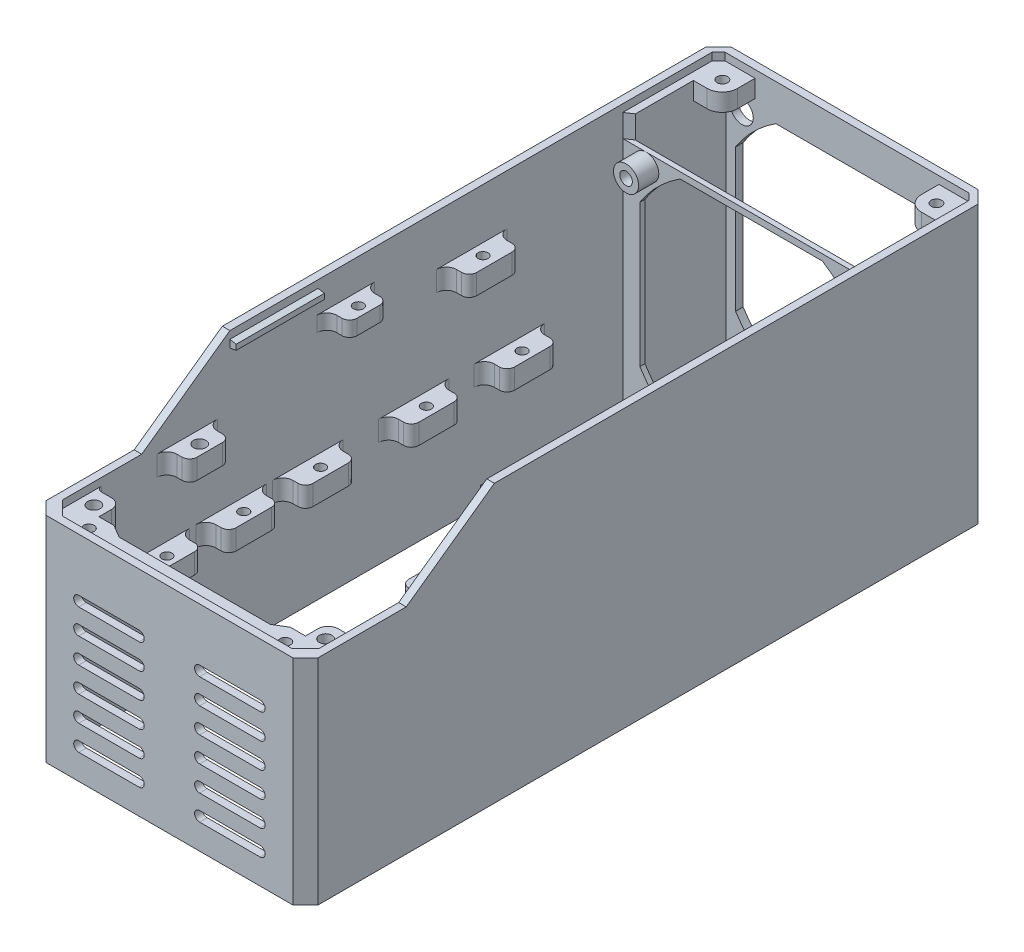
from build123d import *

# Parameters (mm, degrees)
CROQUIS2_W                   = 96
CROQUIS2_H                   = 36
SALIENTE_EXTRUIR1_DEPTH      = 110
CROQUIS3_R                   = 2
SALIENTE_EXTRUIR2_DEPTH      = 8
CROQUIS11_R                  = 2
SALIENTE_EXTRUIR7_DEPTH      = 8
MATRIZL1_COUNT               = 2
MATRIZL1_PITCH               = 38
MATRIZL2_COUNT               = 3
MATRIZL2_PITCH               = 30.5
SIMETR_A1_COPY_1_SKETCH_R    = 2
SIMETR_A1_COPY_1_DEPTH       = 8
SIMETR_A1_COPY_2_SKETCH_R    = 2
SIMETR_A1_COPY_2_DEPTH       = 8
SIMETR_A1_COPY_3_SKETCH_R    = 2
SIMETR_A1_COPY_3_DEPTH       = 8
CORTE_COOLER_DEPTH           = 93
CROQUIS5_R                   = 2.5
CORTE_COOLERAGUJEROS_DEPTH   = 57
EXTRUIR_INSERTOSCOOLER_START = 8
CROQUIS14_R                  = 5
CROQUIS14_R_2                = 2.5
EXTRUIR_INSERTOSCOOLER_DEPTH = 8
CROQUIS20_R                  = 4.5
CORTAR_EXTRUIR6_DEPTH        = 10
CORTAR_EXTRUIR4_DEPTH        = 12
SALIENTE_EXTRUIR10_START     = -3
CROQUIS16_R                  = 2.1
SALIENTE_EXTRUIR10_DEPTH     = 7
CORTAR_EXTRUIR5_DEPTH        = 3
CROQUIS9_R                   = 2
SALIENTE_EXTRUIR6_DEPTH      = 8
SOPORTEFRENTE_START          = 8
CROQUIS18_R                  = 2
SOPORTEFRENTE_DEPTH          = 6
CORTE_TAPABORNERA_DEPTH      = 123
CROQUIS13_R                  = 2.5
CROQUIS13_R_2                = 2.1
SALIENTE_EXTRUIR8_DEPTH      = 8
SALIENTE_CANALETA_DEPTH      = 35
CORTAR_EXTRUIR7_DEPTH        = 10


with BuildPart() as part:
    # Croquis2 → Saliente-Extruir1 (new body)
    with BuildSketch(Plane(origin=(0, 0, 0), x_dir=(1, 0, 0), z_dir=(0, 1, 0))):
        Polygon((49, 125), (-49, 125), (-54, 120), (-54, 0), (-54, -142), (-49, -147), (49, -147), (54, -142), (54, 0), (54, 120), align=None)
        Polygon((-51, 0), (-51, 84), (51, 84), (51, 0), (51, -138.5), (45.5, -144), (-45.5, -144), (-51, -138.5), align=None, mode=Mode.SUBTRACT)
        with Locations((0, 104)):
            Rectangle(CROQUIS2_W, CROQUIS2_H, mode=Mode.SUBTRACT)
    extrude(amount=SALIENTE_EXTRUIR1_DEPTH)

    # Croquis3 → Saliente-Extruir2 (add)
    with BuildSketch(Plane(origin=(0, 50, 0), x_dir=(1, 0, 0), z_dir=(0, 1, 0))):
        with BuildLine():
            Line((-45, 49), (-47, 49))
            ThreePointArc((-47, 49), (-49.828427125, 50.171572875), (-51, 53))
            Line((-51, 53), (-51, 25))
            ThreePointArc((-51, 25), (-49.828427125, 27.828427125), (-47, 29))
            Line((-47, 29), (-45, 29))
            ThreePointArc((-45, 29), (-42.878679656, 29.878679656), (-42, 32))
            Line((-42, 32), (-42, 46))
            ThreePointArc((-42, 46), (-42.878679656, 48.121320344), (-45, 49))
        make_face()
        with Locations(Location((-46, 39, 0), (0, 0, 270))):
            Circle(CROQUIS3_R, mode=Mode.SUBTRACT)
    saliente_extruir2 = extrude(amount=-SALIENTE_EXTRUIR2_DEPTH)

    # Croquis11 → Saliente-Extruir7 (add)
    with BuildSketch(Plane(origin=(0, 50, 0), x_dir=(1, 0, 0), z_dir=(0, 1, 0))):
        with BuildLine():
            ThreePointArc((-47, -31), (-49.828427125, -29.828427125), (-51, -27))
            Line((-51, -27), (-51, -55))
            ThreePointArc((-51, -55), (-49.828427125, -52.171572875), (-47, -51))
            Line((-47, -51), (-45, -51))
            ThreePointArc((-45, -51), (-42.878679656, -50.121320344), (-42, -48))
            Line((-42, -48), (-42, -34))
            ThreePointArc((-42, -34), (-42.878679656, -31.878679656), (-45, -31))
            Line((-45, -31), (-47, -31))
        make_face()
        with Locations(Location((-46, -41, 0), (0, 0, 270))):
            Circle(CROQUIS11_R, mode=Mode.SUBTRACT)
    saliente_extruir7 = extrude(amount=-SALIENTE_EXTRUIR7_DEPTH)

    # MatrizL1: Saliente-Extruir2 ×2
    with Locations(*[(0, 0, i * MATRIZL1_PITCH) for i in range(1, MATRIZL1_COUNT)]):
        add(saliente_extruir2)

    # MatrizL2: Saliente-Extruir7 ×3
    with Locations(*[(0, 0, i * MATRIZL2_PITCH) for i in range(1, MATRIZL2_COUNT)]):
        add(saliente_extruir7)

    # Simetría1: Saliente-Extruir2, Saliente-Extruir7 across plane
    add(saliente_extruir2.mirror(Plane(origin=(0, 0, 0), x_dir=(0, 0, 1), z_dir=(1, 0, 0))))
    add(saliente_extruir7.mirror(Plane(origin=(0, 0, 0), x_dir=(0, 0, 1), z_dir=(1, 0, 0))))

    # Simetría1 copy 1 sketch → Simetría1 copy 1 (add)
    with BuildSketch(Plane(origin=(0, 50, 38), x_dir=(-1, 0, 0), z_dir=(0, 1, 0))):
        with BuildLine():
            Line((-45, -49), (-47, -49))
            ThreePointArc((-47, -49), (-49.828427125, -50.171572875), (-51, -53))
            Line((-51, -53), (-51, -25))
            ThreePointArc((-51, -25), (-49.828427125, -27.828427125), (-47, -29))
            Line((-47, -29), (-45, -29))
            ThreePointArc((-45, -29), (-42.878679656, -29.878679656), (-42, -32))
            Line((-42, -32), (-42, -46))
            ThreePointArc((-42, -46), (-42.878679656, -48.121320344), (-45, -49))
        make_face()
        with Locations((-46, -39)):
            Circle(SIMETR_A1_COPY_1_SKETCH_R, mode=Mode.SUBTRACT)
    extrude(amount=-SIMETR_A1_COPY_1_DEPTH)

    # Simetría1 copy 2 sketch → Simetría1 copy 2 (add)
    with BuildSketch(Plane(origin=(0, 50, 30.5), x_dir=(-1, 0, 0), z_dir=(0, 1, 0))):
        with BuildLine():
            ThreePointArc((-47, 31), (-49.828427125, 29.828427125), (-51, 27))
            Line((-51, 27), (-51, 55))
            ThreePointArc((-51, 55), (-49.828427125, 52.171572875), (-47, 51))
            Line((-47, 51), (-45, 51))
            ThreePointArc((-45, 51), (-42.878679656, 50.121320344), (-42, 48))
            Line((-42, 48), (-42, 34))
            ThreePointArc((-42, 34), (-42.878679656, 31.878679656), (-45, 31))
            Line((-45, 31), (-47, 31))
        make_face()
        with Locations((-46, 41)):
            Circle(SIMETR_A1_COPY_2_SKETCH_R, mode=Mode.SUBTRACT)
    extrude(amount=-SIMETR_A1_COPY_2_DEPTH)

    # Simetría1 copy 3 sketch → Simetría1 copy 3 (add)
    with BuildSketch(Plane(origin=(0, 50, 61), x_dir=(-1, 0, 0), z_dir=(0, 1, 0))):
        with BuildLine():
            ThreePointArc((-47, 31), (-49.828427125, 29.828427125), (-51, 27))
            Line((-51, 27), (-51, 55))
            ThreePointArc((-51, 55), (-49.828427125, 52.171572875), (-47, 51))
            Line((-47, 51), (-45, 51))
            ThreePointArc((-45, 51), (-42.878679656, 50.121320344), (-42, 48))
            Line((-42, 48), (-42, 34))
            ThreePointArc((-42, 34), (-42.878679656, 31.878679656), (-45, 31))
            Line((-45, 31), (-47, 31))
        make_face()
        with Locations((-46, 41)):
            Circle(SIMETR_A1_COPY_3_SKETCH_R, mode=Mode.SUBTRACT)
    extrude(amount=-SIMETR_A1_COPY_3_DEPTH)

    # Croquis4 → Corte-Cooler (cut)
    with BuildSketch(Plane.XY.offset(-84)):
        with BuildLine():
            Line((-28.252212303, 95.5), (28.252212303, 95.5))
            ThreePointArc((28.252212303, 95.5), (37.123106012, 88.373106012), (44.25, 79.502212303))
            Line((44.25, 79.502212303), (44.25, 22.997787697))
            ThreePointArc((44.25, 22.997787697), (37.123106012, 14.126893988), (28.252212303, 7))
            Line((28.252212303, 7), (-28.252212303, 7))
            ThreePointArc((-28.252212303, 7), (-37.123106012, 14.126893988), (-44.25, 22.997787697))
            Line((-44.25, 22.997787697), (-44.25, 79.502212303))
            ThreePointArc((-44.25, 79.502212303), (-37.123106012, 88.373106012), (-28.252212303, 95.5))
        make_face()
    extrude(amount=-CORTE_COOLER_DEPTH, mode=Mode.SUBTRACT)

    # Croquis5 → Corte-CoolerAgujeros (cut)
    with BuildSketch(Plane.XY.offset(-84)):
        with Locations((-41.71930009, 92.96930009)):
            Circle(CROQUIS5_R)
        with Locations((41.71930009, 92.96930009)):
            Circle(CROQUIS5_R)
        with Locations((41.71930009, 9.53069991)):
            Circle(CROQUIS5_R)
        with Locations((-41.71930009, 9.53069991)):
            Circle(CROQUIS5_R)
    extrude(amount=-CORTE_COOLERAGUJEROS_DEPTH, mode=Mode.SUBTRACT)

    # Croquis14 → Extruir-InsertosCooler (add)
    # profile 1 of 4: a face of its own
    with BuildSketch(Plane.XY.offset(-84).offset(EXTRUIR_INSERTOSCOOLER_START)):
        with Locations((41.71930009, 92.96930009)):
            Circle(CROQUIS14_R)
        with Locations((41.71930009, 92.96930009)):
            Circle(CROQUIS14_R_2, mode=Mode.SUBTRACT)
    # profile 2 of 4: a face of its own
    with BuildSketch(Plane.XY.offset(-84).offset(EXTRUIR_INSERTOSCOOLER_START)):
        with Locations((-41.71930009, 92.96930009)):
            Circle(CROQUIS14_R)
        with Locations((-41.71930009, 92.96930009)):
            Circle(CROQUIS14_R_2, mode=Mode.SUBTRACT)
    # profile 3 of 4: a face of its own
    with BuildSketch(Plane.XY.offset(-84).offset(EXTRUIR_INSERTOSCOOLER_START)):
        with Locations((-41.71930009, 9.53069991)):
            Circle(CROQUIS14_R)
        with Locations((-41.71930009, 9.53069991)):
            Circle(CROQUIS14_R_2, mode=Mode.SUBTRACT)
    # profile 4 of 4: a face of its own
    with BuildSketch(Plane.XY.offset(-84).offset(EXTRUIR_INSERTOSCOOLER_START)):
        with Locations((41.71930009, 9.53069991)):
            Circle(CROQUIS14_R)
        with Locations((41.71930009, 9.53069991)):
            Circle(CROQUIS14_R_2, mode=Mode.SUBTRACT)
    extrude(amount=-EXTRUIR_INSERTOSCOOLER_DEPTH)

    # Croquis20 → Cortar-Extruir6 (cut)
    with BuildSketch(Plane(origin=(0, 0, -125), x_dir=(-1, 0, 0), z_dir=(0, 0, -1))):
        with Locations((41.71930009, 92.96930009)):
            Circle(CROQUIS20_R)
        with Locations((-41.71930009, 92.96930009)):
            Circle(CROQUIS20_R)
        with Locations((41.71930009, 9.53069991)):
            Circle(CROQUIS20_R)
        with Locations((-41.71930009, 9.53069991)):
            Circle(CROQUIS20_R)
    extrude(amount=-CORTAR_EXTRUIR6_DEPTH, mode=Mode.SUBTRACT)

    # Croquis15 → Cortar-Extruir4 (cut)
    with BuildSketch(Plane(origin=(0, 110, 0), x_dir=(1, 0, 0), z_dir=(0, 1, 0))):
        Polygon((-48, 86), (48, 86), (51, 84), (-51, 84), align=None)
    extrude(amount=-CORTAR_EXTRUIR4_DEPTH, mode=Mode.SUBTRACT)

    # Croquis16 → Saliente-Extruir10 (add)
    # profile 1 of 2: a face of its own
    with BuildSketch(Plane(origin=(0, 110, 0), x_dir=(1, 0, 0), z_dir=(0, 1, 0)).offset(SALIENTE_EXTRUIR10_START)):
        with BuildLine():
            Line((-48, 109), (-42.5, 109))
            ThreePointArc((-42.5, 109), (-38.257359313, 110.757359313), (-36.5, 115))
            Line((-36.5, 115), (-36.5, 122))
            Line((-36.5, 122), (-48, 122))
            Line((-48, 122), (-48, 109))
        make_face()
        with Locations(Location((-42.5, 115, 0), (0, 0, 270))):
            Circle(CROQUIS16_R, mode=Mode.SUBTRACT)
    # profile 2 of 2: a face of its own
    with BuildSketch(Plane(origin=(0, 110, 0), x_dir=(1, 0, 0), z_dir=(0, 1, 0)).offset(SALIENTE_EXTRUIR10_START)):
        with BuildLine():
            Line((48, 122), (36.5, 122))
            Line((36.5, 122), (36.5, 115))
            ThreePointArc((36.5, 115), (38.257359313, 110.757359313), (42.5, 109))
            Line((42.5, 109), (48, 109))
            Line((48, 109), (48, 122))
        make_face()
        with Locations(Location((42.5, 115, 0), (0, 0, 270))):
            Circle(CROQUIS16_R, mode=Mode.SUBTRACT)
    extrude(amount=-SALIENTE_EXTRUIR10_DEPTH)

    # Croquis17 → Cortar-Extruir5 (cut)
    with BuildSketch(Plane(origin=(0, 110, 0), x_dir=(1, 0, 0), z_dir=(0, 1, 0))):
        Polygon((-36.5, 122), (-48.464466094, 122), (-51, 119.464466094), (-51, 84), (-47.467585857, 84), (-47.467585857, 109), (-47.467585857, 111.59850169), (-39.066087547, 120), (-36.5, 120), align=None)
        Polygon((47.467585857, 84), (47.467585857, 109), (47.467585857, 111.59850169), (39.066087547, 120), (36.5, 120), (36.5, 122), (48.464466094, 122), (51, 119.464466094), (51, 84), align=None)
    extrude(amount=-CORTAR_EXTRUIR5_DEPTH, mode=Mode.SUBTRACT)

    # Croquis9 → Saliente-Extruir6 (add)
    # profile 1 of 3: a face of its own
    with BuildSketch(Plane(origin=(0, 90, 0), x_dir=(1, 0, 0), z_dir=(0, 1, 0))):
        with BuildLine():
            ThreePointArc((-47, 14), (-49.828427125, 12.828427125), (-51, 10))
            Line((-51, 10), (-51, 38))
            ThreePointArc((-51, 38), (-49.828427125, 35.171572875), (-47, 34))
            Line((-47, 34), (-45, 34))
            ThreePointArc((-45, 34), (-42.878679656, 33.121320344), (-42, 31))
            Line((-42, 31), (-42, 17))
            ThreePointArc((-42, 17), (-42.878679656, 14.878679656), (-45, 14))
            Line((-45, 14), (-47, 14))
        make_face()
        with Locations(Location((-46.5, 24, 0), (0, 0, 270))):
            Circle(CROQUIS9_R, mode=Mode.SUBTRACT)
    # profile 2 of 3: a face of its own
    with BuildSketch(Plane(origin=(0, 90, 0), x_dir=(1, 0, 0), z_dir=(0, 1, 0))):
        with BuildLine():
            ThreePointArc((42, 61), (42.878679656, 63.121320344), (45, 64))
            Line((45, 64), (47, 64))
            ThreePointArc((47, 64), (49.828427125, 65.171572875), (51, 68))
            Line((51, 68), (51, 40))
            ThreePointArc((51, 40), (49.828427125, 42.828427125), (47, 44))
            Line((47, 44), (45, 44))
            ThreePointArc((45, 44), (42.878679656, 44.878679656), (42, 47))
            Line((42, 47), (42, 61))
        make_face()
        with Locations(Location((46, 54, 0), (0, 0, 270))):
            Circle(CROQUIS9_R, mode=Mode.SUBTRACT)
    # profile 3 of 3: a face of its own
    with BuildSketch(Plane(origin=(0, 90, 0), x_dir=(1, 0, 0), z_dir=(0, 1, 0))):
        with BuildLine():
            ThreePointArc((42, 21), (42.878679656, 23.121320344), (45, 24))
            Line((45, 24), (47, 24))
            ThreePointArc((47, 24), (49.828427125, 25.171572875), (51, 28))
            Line((51, 28), (51, 0))
            ThreePointArc((51, 0), (49.828427125, 2.828427125), (47, 4))
            Line((47, 4), (45, 4))
            ThreePointArc((45, 4), (42.878679656, 4.878679656), (42, 7))
            Line((42, 7), (42, 21))
        make_face()
        with Locations(Location((46, 14, 0), (0, 0, 270))):
            Circle(CROQUIS9_R, mode=Mode.SUBTRACT)
    extrude(amount=-SALIENTE_EXTRUIR6_DEPTH)

    # Croquis18 → SoporteFrente (add)
    # profile 1 of 2: a face of its own
    with BuildSketch(Plane(origin=(0, 90, 0), x_dir=(1, 0, 0), z_dir=(0, 1, 0)).offset(SOPORTEFRENTE_START)):
        with BuildLine():
            Line((47, -18.5), (45, -18.5))
            ThreePointArc((45, -18.5), (42.878679656, -19.378679656), (42, -21.5))
            Line((42, -21.5), (42, -30.5))
            ThreePointArc((42, -30.5), (42.878679656, -32.621320344), (45, -33.5))
            Line((45, -33.5), (47, -33.5))
            ThreePointArc((47, -33.5), (49.828427125, -34.671572875), (51, -37.5))
            Line((51, -37.5), (51, -14.5))
            ThreePointArc((51, -14.5), (49.828427125, -17.328427125), (47, -18.5))
        make_face()
        with Locations(Location((46, -26, 0), (0, 0, 270))):
            Circle(CROQUIS18_R, mode=Mode.SUBTRACT)
    # profile 2 of 2: a face of its own
    with BuildSketch(Plane(origin=(0, 90, 0), x_dir=(1, 0, 0), z_dir=(0, 1, 0)).offset(SOPORTEFRENTE_START)):
        with BuildLine():
            ThreePointArc((-47, -33.5), (-49.828427125, -34.671572875), (-51, -37.5))
            Line((-51, -37.5), (-51, -14.5))
            ThreePointArc((-51, -14.5), (-49.828427125, -17.328427125), (-47, -18.5))
            Line((-47, -18.5), (-45, -18.5))
            ThreePointArc((-45, -18.5), (-42.878679656, -19.378679656), (-42, -21.5))
            Line((-42, -21.5), (-42, -30.5))
            ThreePointArc((-42, -30.5), (-42.878679656, -32.621320344), (-45, -33.5))
            Line((-45, -33.5), (-47, -33.5))
        make_face()
        with Locations(Location((-46, -26, 0), (0, 0, 270))):
            Circle(CROQUIS18_R, mode=Mode.SUBTRACT)
    extrude(amount=-SOPORTEFRENTE_DEPTH)

    # Croquis10 → Corte-TapaBornera (cut)
    with BuildSketch(Plane(origin=(54, 0, 0), x_dir=(0, 0, -1), z_dir=(1, 0, 0))):
        Polygon((-147, 110), (-147, 85), (-107, 85), (-72, 110), align=None)
    extrude(amount=-CORTE_TAPABORNERA_DEPTH, mode=Mode.SUBTRACT)

    # Croquis13 → Saliente-Extruir8 (add)
    # profile 1 of 2: a face of its own
    with BuildSketch(Plane(origin=(0, 82, 0), x_dir=(1, 0, 0), z_dir=(0, 1, 0))):
        with BuildLine():
            Line((-51, -77), (-51, -101))
            ThreePointArc((-51, -101), (-49.828427125, -98.171572875), (-47, -97))
            Line((-47, -97), (-45, -97))
            ThreePointArc((-45, -97), (-42.878679656, -96.121320344), (-42, -94))
            Line((-42, -94), (-42, -84))
            ThreePointArc((-42, -84), (-42.878679656, -81.878679656), (-45, -81))
            Line((-45, -81), (-47, -81))
            ThreePointArc((-47, -81), (-49.828427125, -79.828427125), (-51, -77))
        make_face()
        with Locations(Location((-46, -89, 0), (0, 0, 270))):
            Circle(CROQUIS13_R, mode=Mode.SUBTRACT)
    # profile 2 of 2: a face of its own
    with BuildSketch(Plane(origin=(0, 82, 0), x_dir=(1, 0, 0), z_dir=(0, 1, 0))):
        with BuildLine():
            Line((-35, -134), (-41, -134))
            Line((-41, -134), (-41, -129))
            ThreePointArc((-41, -129), (-42.171572875, -126.171572875), (-45, -125))
            Line((-45, -125), (-49, -125))
            ThreePointArc((-49, -125), (-50.414213562, -124.414213562), (-51, -123))
            Line((-51, -123), (-51, -138.5))
            Line((-51, -138.5), (-45.5, -144))
            Line((-45.5, -144), (0, -144))
            Line((0, -144), (0, -137))
            Line((0, -137), (-30, -137))
            Line((-30, -137), (-35, -134))
        make_face()
        with Locations(Location((-39, -140, 0), (0, 0, 270))):
            Circle(CROQUIS13_R_2, mode=Mode.SUBTRACT)
        with Locations(Location((-46, -131, 0), (0, 0, 270))):
            Circle(CROQUIS13_R, mode=Mode.SUBTRACT)
    saliente_extruir8 = extrude(amount=-SALIENTE_EXTRUIR8_DEPTH)

    # Simetría2: Saliente-Extruir8 across plane
    add(saliente_extruir8.mirror(Plane(origin=(0, 0, 0), x_dir=(0, 0, 1), z_dir=(1, 0, 0))))

    # Croquis19 → Saliente-Canaleta (add)
    with BuildSketch(Plane.XY.offset(37)):
        Polygon((51, 104), (51, 107), (48.5, 106.559182548), (48.5, 104.440817452), align=None)
        Polygon((-51, 107), (-51, 104), (-48.5, 104.440817452), (-48.5, 106.559182548), align=None)
    extrude(amount=SALIENTE_CANALETA_DEPTH)

    # Croquis21 → Cortar-Extruir7 (cut)
    with BuildSketch(Plane.XY.offset(147)):
        with BuildLine():
            Line((36, 60), (12, 60))
            ThreePointArc((12, 60), (10, 62), (12, 64))
            Line((12, 64), (36, 64))
            ThreePointArc((36, 64), (38, 62), (36, 60))
        make_face()
        with BuildLine():
            Line((36, 50), (12, 50))
            ThreePointArc((12, 50), (10, 52), (12, 54))
            Line((12, 54), (36, 54))
            ThreePointArc((36, 54), (38, 52), (36, 50))
        make_face()
        with BuildLine():
            Line((36, 40), (12, 40))
            ThreePointArc((12, 40), (10, 42), (12, 44))
            Line((12, 44), (36, 44))
            ThreePointArc((36, 44), (38, 42), (36, 40))
        make_face()
        with BuildLine():
            Line((36, 30), (12, 30))
            ThreePointArc((12, 30), (10, 32), (12, 34))
            Line((12, 34), (36, 34))
            ThreePointArc((36, 34), (38, 32), (36, 30))
        make_face()
        with BuildLine():
            Line((36, 20), (12, 20))
            ThreePointArc((12, 20), (10, 22), (12, 24))
            Line((12, 24), (36, 24))
            ThreePointArc((36, 24), (38, 22), (36, 20))
        make_face()
        with BuildLine():
            Line((36, 10), (12, 10))
            ThreePointArc((12, 10), (10, 12), (12, 14))
            Line((12, 14), (36, 14))
            ThreePointArc((36, 14), (38, 12), (36, 10))
        make_face()
        with BuildLine():
            Line((-12, 50), (-36, 50))
            ThreePointArc((-36, 50), (-38, 52), (-36, 54))
            Line((-36, 54), (-12, 54))
            ThreePointArc((-12, 54), (-10, 52), (-12, 50))
        make_face()
        with BuildLine():
            Line((-12, 40), (-36, 40))
            ThreePointArc((-36, 40), (-38, 42), (-36, 44))
            Line((-36, 44), (-12, 44))
            ThreePointArc((-12, 44), (-10, 42), (-12, 40))
        make_face()
        with BuildLine():
            Line((-12, 30), (-36, 30))
            ThreePointArc((-36, 30), (-38, 32), (-36, 34))
            Line((-36, 34), (-12, 34))
            ThreePointArc((-12, 34), (-10, 32), (-12, 30))
        make_face()
        with BuildLine():
            Line((-12, 20), (-36, 20))
            ThreePointArc((-36, 20), (-38, 22), (-36, 24))
            Line((-36, 24), (-12, 24))
            ThreePointArc((-12, 24), (-10, 22), (-12, 20))
        make_face()
        with BuildLine():
            Line((-12, 10), (-36, 10))
            ThreePointArc((-36, 10), (-38, 12), (-36, 14))
            Line((-36, 14), (-12, 14))
            ThreePointArc((-12, 14), (-10, 12), (-12, 10))
        make_face()
        with BuildLine():
            Line((-12, 60), (-36, 60))
            ThreePointArc((-36, 60), (-38, 62), (-36, 64))
            Line((-36, 64), (-12, 64))
            ThreePointArc((-12, 64), (-10, 62), (-12, 60))
        make_face()
    extrude(amount=-CORTAR_EXTRUIR7_DEPTH, mode=Mode.SUBTRACT)


solid = part.part
